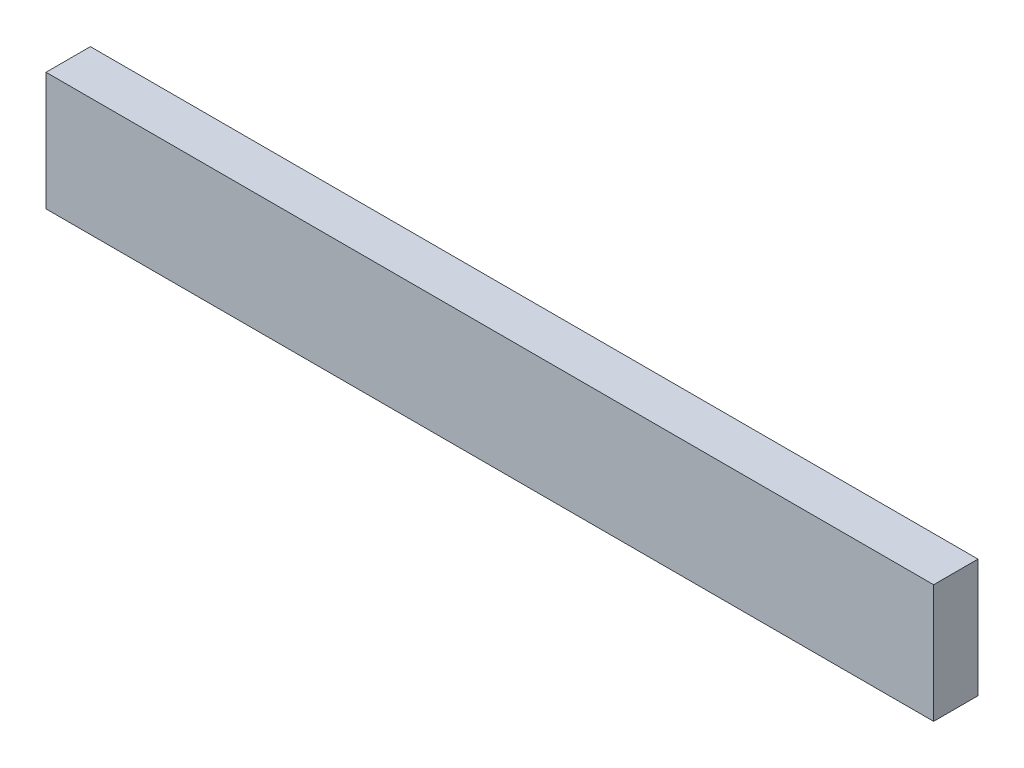
from build123d import *

# Parameters (mm, degrees)
CROQUIS1_W              = 60
CROQUIS1_H              = 8
SALIENTE_EXTRUIR1_DEPTH = 3


with BuildPart() as part:
    # Croquis1 → Saliente-Extruir1 (new body)
    with BuildSketch(Plane.XY):
        with Locations((30, 4)):
            Rectangle(CROQUIS1_W, CROQUIS1_H)
    extrude(amount=SALIENTE_EXTRUIR1_DEPTH)


solid = part.part
